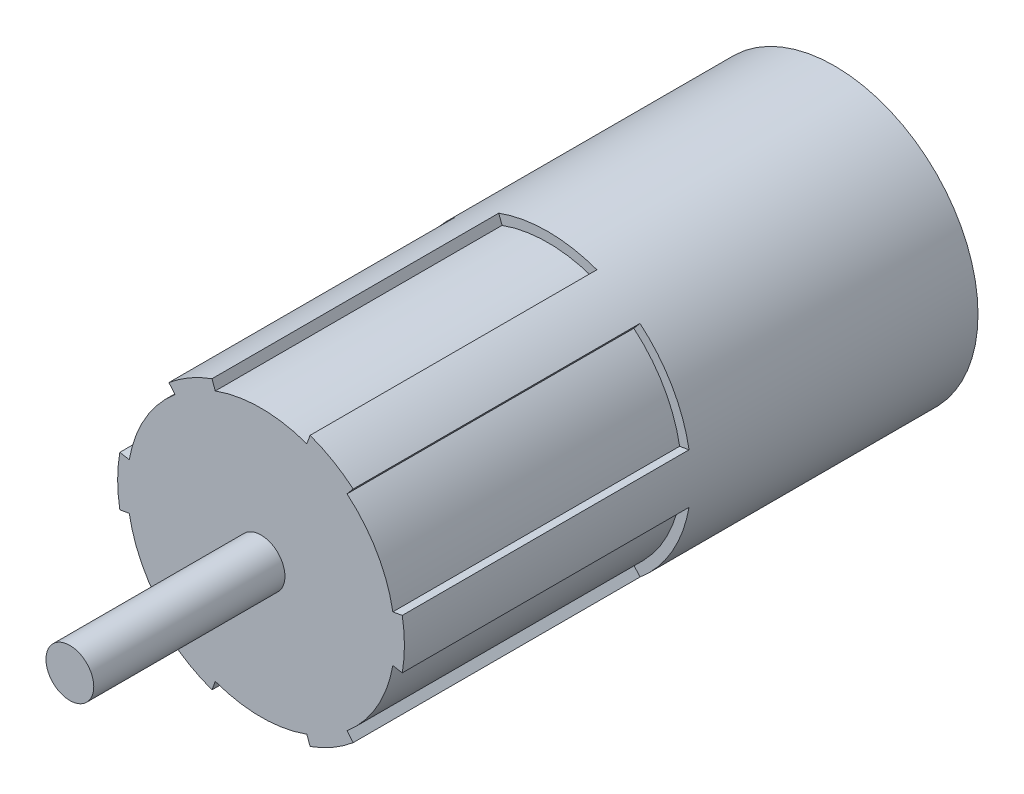
from build123d import *

# Parameters (mm, degrees)
SKETCH1_R           = 15
BOSS_EXTRUDE1_DEPTH = 30
SKETCH2_R           = 2.5
BOSS_EXTRUDE2_DEPTH = 20
CUT_EXTRUDE2_DEPTH  = 30
CIRPATTERN2_COUNT   = 6


with BuildPart() as part:
    # Sketch1 → Boss-Extrude1 (new, symmetric)
    with BuildSketch(Plane.XY):
        with Locations(Location((0, 0, 0), (0, 0, 180))):
            Circle(SKETCH1_R)
    extrude(amount=BOSS_EXTRUDE1_DEPTH, both=True)

    # Sketch2 → Boss-Extrude2 (add)
    with BuildSketch(Plane.XY.offset(30)):
        Circle(SKETCH2_R)
    extrude(amount=BOSS_EXTRUDE2_DEPTH)

    # Sketch4 → Cut-Extrude2 (cut)
    with BuildSketch(Plane.XY.offset(30)):
        with BuildLine():
            Line((-4.788282007, 13.155696691), (-5.13030215, 14.095389312))
            ThreePointArc((-5.13030215, 14.095389312), (0, 15), (5.13030215, 14.095389312))
            Line((5.13030215, 14.095389312), (4.788282007, 13.155696691))
            ThreePointArc((4.788282007, 13.155696691), (0, 14), (-4.788282007, 13.155696691))
        make_face()
    cut_extrude2 = extrude(amount=-CUT_EXTRUDE2_DEPTH, mode=Mode.SUBTRACT)

    # CirPattern2: Cut-Extrude2 ×6 about axis
    cirpattern2_axis = Axis((0, 0, 0), (0, 0, 1))
    for i in range(1, CIRPATTERN2_COUNT):
        add(cut_extrude2.rotate(cirpattern2_axis, i * 360 / CIRPATTERN2_COUNT), mode=Mode.SUBTRACT)


solid = part.part
